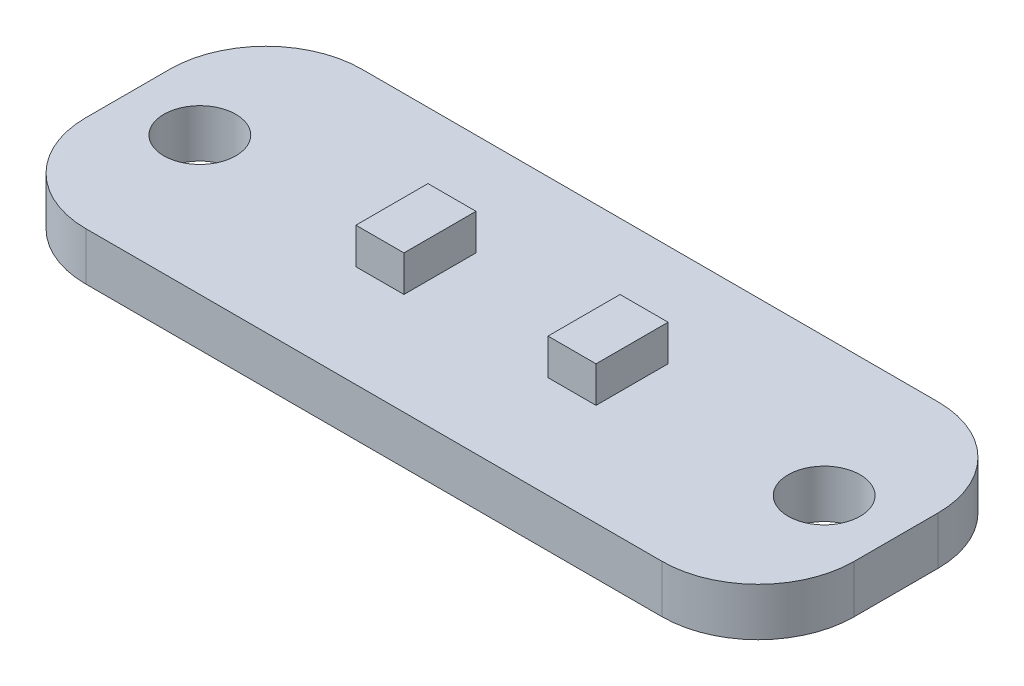
from build123d import *

# Parameters (mm, degrees)
SKETCH1_W           = 32
SKETCH1_H           = 11.5
BOSS_EXTRUDE1_DEPTH = 2
SKETCH2_R           = 1.5
CUT_EXTRUDE1_DEPTH  = 35.062442661
FILLET1_R           = 4
SKETCH3_W           = 2
SKETCH3_H           = 3
BOSS_EXTRUDE2_DEPTH = 1.5


with BuildPart() as part:
    # Sketch1 → Boss-Extrude1 (new body)
    with BuildSketch(Plane(origin=(0, 0, 0), x_dir=(1, 0, 0), z_dir=(0, 1, 0))):
        with Locations((16, -5.75)):
            Rectangle(SKETCH1_W, SKETCH1_H)
    extrude(amount=BOSS_EXTRUDE1_DEPTH)

    # Sketch2 → Cut-Extrude1 (cut, through all)
    with BuildSketch(Plane(origin=(0, 2, 0), x_dir=(1, 0, 0), z_dir=(0, 1, 0))):
        with Locations(Location((3, -5.75, 0), (0, 0, 270))):
            Circle(SKETCH2_R)
        with Locations(Location((29, -5.75, 0), (0, 0, 270))):
            Circle(SKETCH2_R)
    extrude(amount=-CUT_EXTRUDE1_DEPTH, mode=Mode.SUBTRACT)

    # Fillet1
    fillet1_edges = [part.edges().sort_by_distance(p)[0] for p in [
        (0, 1, 0),
        (32, 1, 0),
        (32, 1, 11.5),
        (0, 1, 11.5),
    ]]
    fillet(fillet1_edges, radius=FILLET1_R)

    # Sketch3 → Boss-Extrude2 (add)
    with BuildSketch(Plane(origin=(0, 2, 0), x_dir=(1, 0, 0), z_dir=(0, 1, 0))):
        with Locations((12, -5.75)):
            Rectangle(SKETCH3_W, SKETCH3_H)
        with Locations((20, -5.75)):
            Rectangle(SKETCH3_W, SKETCH3_H)
    extrude(amount=BOSS_EXTRUDE2_DEPTH)


solid = part.part
